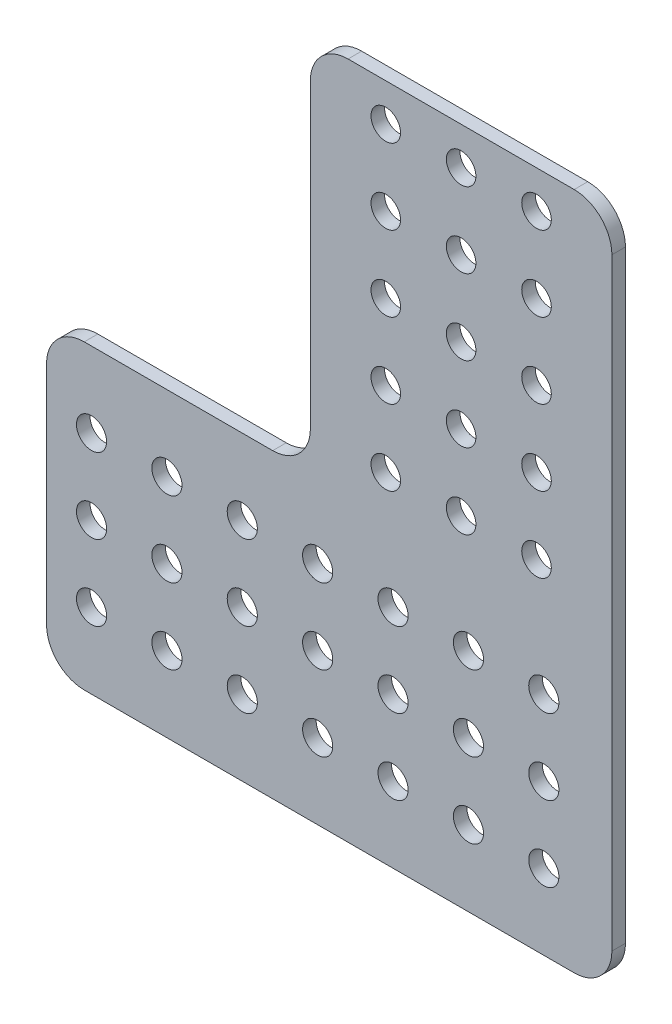
from build123d import *

# Parameters (mm, degrees)
SKETCH1_R           = 2.54
SKETCH1_R_2         = 2.4892
BOSS_EXTRUDE1_DEPTH = 2.286
FILLET1_R           = 6.35


with BuildPart() as part:
    # Sketch1 → Boss-Extrude1 (new body)
    with BuildSketch(Plane(origin=(0, 0, -219.608471563), x_dir=(-1, 0, 0), z_dir=(0, 0, -1))):
        Polygon((77.53656774, 159.000825673), (77.53656774, 108.200825673), (-17.71343226, 108.200825673), (-17.71343226, 222.500825674), (33.08656774, 222.500825674), (33.08656774, 159.000825673), align=None)
        with Locations((44.553419861, 120.900826428)):
            Circle(SKETCH1_R, mode=Mode.SUBTRACT)
        with Locations((57.257798242, 133.600825673)):
            Circle(SKETCH1_R, mode=Mode.SUBTRACT)
        with Locations((69.957798242, 146.300825673)):
            Circle(SKETCH1_R, mode=Mode.SUBTRACT)
        with Locations((69.957798242, 133.600825673)):
            Circle(SKETCH1_R, mode=Mode.SUBTRACT)
        with Locations((69.957798242, 120.900825673)):
            Circle(SKETCH1_R, mode=Mode.SUBTRACT)
        with Locations((57.253419861, 120.900826428)):
            Circle(SKETCH1_R, mode=Mode.SUBTRACT)
        with Locations((20.38656774, 165.350825674)):
            Circle(SKETCH1_R_2, mode=Mode.SUBTRACT)
        with Locations((-6.242201758, 146.300824919)):
            Circle(SKETCH1_R, mode=Mode.SUBTRACT)
        with Locations((-6.246580139, 133.600825673)):
            Circle(SKETCH1_R, mode=Mode.SUBTRACT)
        with Locations((6.457798242, 146.300825673)):
            Circle(SKETCH1_R, mode=Mode.SUBTRACT)
        with Locations((6.453419861, 133.600826428)):
            Circle(SKETCH1_R, mode=Mode.SUBTRACT)
        with Locations((19.157798242, 146.300825673)):
            Circle(SKETCH1_R, mode=Mode.SUBTRACT)
        with Locations((-6.246580139, 120.900825673)):
            Circle(SKETCH1_R, mode=Mode.SUBTRACT)
        with Locations((6.453419861, 120.900826428)):
            Circle(SKETCH1_R, mode=Mode.SUBTRACT)
        with Locations((19.153419861, 120.900826428)):
            Circle(SKETCH1_R, mode=Mode.SUBTRACT)
        with Locations((19.157798242, 133.600825673)):
            Circle(SKETCH1_R, mode=Mode.SUBTRACT)
        with Locations((31.857798242, 133.600825673)):
            Circle(SKETCH1_R, mode=Mode.SUBTRACT)
        with Locations((44.557798242, 133.600825673)):
            Circle(SKETCH1_R, mode=Mode.SUBTRACT)
        with Locations((31.857798242, 146.300825673)):
            Circle(SKETCH1_R, mode=Mode.SUBTRACT)
        with Locations((44.557798242, 146.300825673)):
            Circle(SKETCH1_R, mode=Mode.SUBTRACT)
        with Locations((57.257798242, 146.300825673)):
            Circle(SKETCH1_R, mode=Mode.SUBTRACT)
        with Locations((31.853419861, 120.900826428)):
            Circle(SKETCH1_R, mode=Mode.SUBTRACT)
        with Locations((-5.01343226, 216.150825674)):
            Circle(SKETCH1_R_2, mode=Mode.SUBTRACT)
        with Locations((7.68656774, 216.150825674)):
            Circle(SKETCH1_R_2, mode=Mode.SUBTRACT)
        with Locations((20.38656774, 216.150825674)):
            Circle(SKETCH1_R_2, mode=Mode.SUBTRACT)
        with Locations((-5.01343226, 203.450825674)):
            Circle(SKETCH1_R_2, mode=Mode.SUBTRACT)
        with Locations((7.68656774, 203.450825674)):
            Circle(SKETCH1_R_2, mode=Mode.SUBTRACT)
        with Locations((20.38656774, 203.450825674)):
            Circle(SKETCH1_R_2, mode=Mode.SUBTRACT)
        with Locations((-5.01343226, 190.750825674)):
            Circle(SKETCH1_R_2, mode=Mode.SUBTRACT)
        with Locations((7.68656774, 190.750825674)):
            Circle(SKETCH1_R_2, mode=Mode.SUBTRACT)
        with Locations((20.38656774, 190.750825674)):
            Circle(SKETCH1_R_2, mode=Mode.SUBTRACT)
        with Locations((-5.01343226, 178.050825674)):
            Circle(SKETCH1_R_2, mode=Mode.SUBTRACT)
        with Locations((7.68656774, 178.050825674)):
            Circle(SKETCH1_R_2, mode=Mode.SUBTRACT)
        with Locations((20.38656774, 178.050825674)):
            Circle(SKETCH1_R_2, mode=Mode.SUBTRACT)
        with Locations((-5.01343226, 165.350825674)):
            Circle(SKETCH1_R_2, mode=Mode.SUBTRACT)
        with Locations((7.68656774, 165.350825674)):
            Circle(SKETCH1_R_2, mode=Mode.SUBTRACT)
    extrude(amount=BOSS_EXTRUDE1_DEPTH)

    # Fillet1
    fillet1_edges = [part.edges().sort_by_distance(p)[0] for p in [
        (17.71343226, 108.200825673, -220.751471563),
        (17.71343226, 222.500825674, -220.751471563),
        (-33.08656774, 222.500825674, -220.751471563),
        (-33.08656774, 159.000825673, -220.751471563),
        (-77.53656774, 159.000825673, -220.751471563),
        (-77.53656774, 108.200825673, -220.751471563),
    ]]
    fillet(fillet1_edges, radius=FILLET1_R)


solid = part.part
